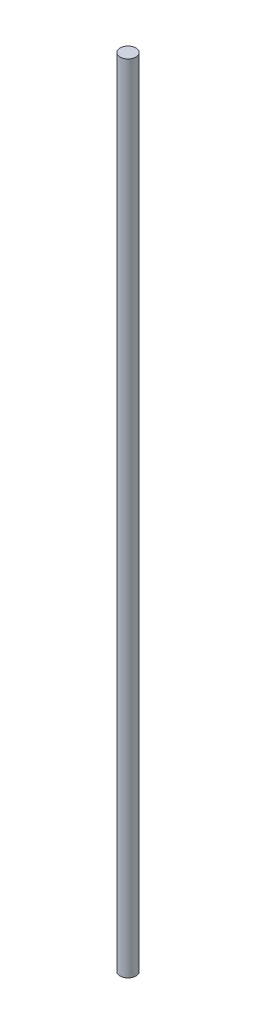
from build123d import *

# Parameters (mm, degrees)
SKETCH_1_R      = 1.5
EXTRUDE_1_DEPTH = 150


with BuildPart() as part:
    # 草图1 → 凸台-拉伸1 (new body)
    with BuildSketch(Plane(origin=(0, 0, 0), x_dir=(1, 0, 0), z_dir=(0, 1, 0))):
        with Locations(Location((0, 0, 0), (0, 0, 270))):
            Circle(SKETCH_1_R)
    extrude(amount=EXTRUDE_1_DEPTH)


solid = part.part
